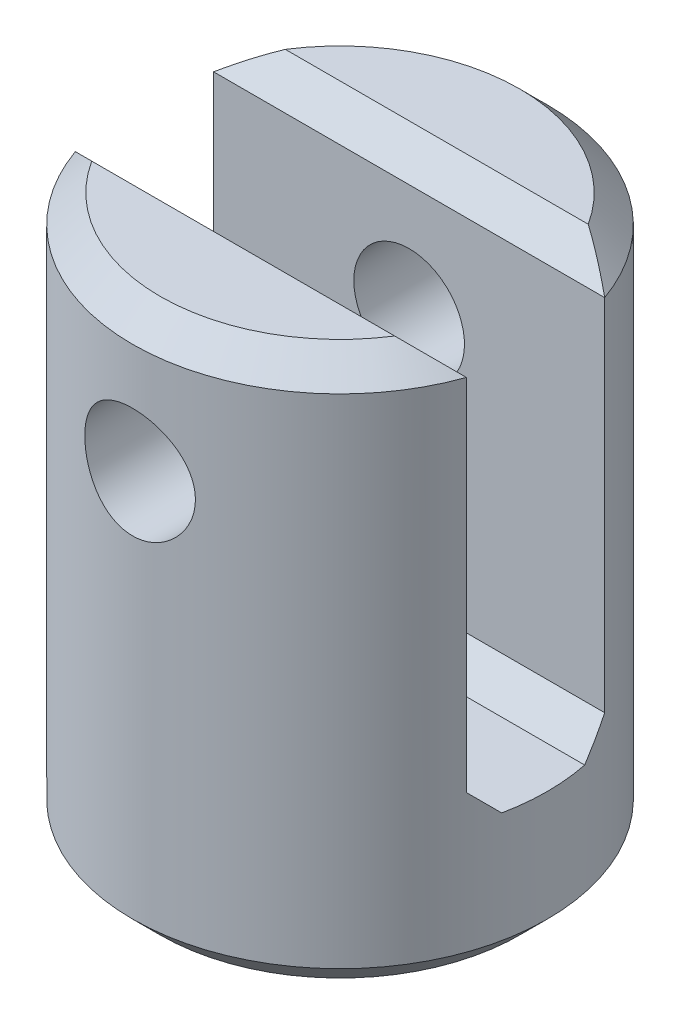
from build123d import *

# Parameters (mm, degrees)
ESBO_O1_R                  = 7.5
RESSALTO_EXTRUS_O1_DEPTH   = 10
CORTE_EXTRUS_O1_DEPTH      = 15.577379737
CORTE_EXTRUS_O1_DEPTH_BACK = 15.577379737
ESBO_O2_W                  = 5
ESBO_O2_H                  = 15
CORTE_EXTRUS_O2_DEPTH      = 15.577379737
CORTE_EXTRUS_O2_DEPTH_BACK = 15.577379737
ESBO_O3_R                  = 2
CHANFRO1_SIZE              = 1
CHANFRO2_SIZE              = 1
CHANFRO3_SIZE              = 1


with BuildPart() as part:
    # Esboço1 → Ressalto-extrusão1 (new, symmetric)
    with BuildSketch(Plane(origin=(0, 0, 0), x_dir=(1, 0, 0), z_dir=(0, 1, 0))):
        with Locations(Location((0, 0, 0), (0, 0, 270))):
            Circle(ESBO_O1_R)
    extrude(amount=RESSALTO_EXTRUS_O1_DEPTH, both=True)

    # Esboço2 → Corte-extrusão1 (cut, two sides: drawn at the far end of the back side and taken through both)
    with BuildSketch(Plane(origin=(0, 0, 0), x_dir=(0, 0, -1), z_dir=(1, 0, 0)).offset(-CORTE_EXTRUS_O1_DEPTH_BACK)):
        with Locations((0, 2.5)):
            Rectangle(ESBO_O2_W, ESBO_O2_H)
    extrude(amount=CORTE_EXTRUS_O1_DEPTH + CORTE_EXTRUS_O1_DEPTH_BACK, mode=Mode.SUBTRACT)

    # Esboço3 → Corte-extrusão2 (cut, two sides: drawn at the far end of the back side and taken through both)
    with BuildSketch(Plane.XY.offset(-CORTE_EXTRUS_O2_DEPTH_BACK)):
        with Locations(Location((0, 5, 0), (0, 0, 90))):
            Circle(ESBO_O3_R)
    extrude(amount=CORTE_EXTRUS_O2_DEPTH + CORTE_EXTRUS_O2_DEPTH_BACK, mode=Mode.SUBTRACT)

    # Chanfro1
    chanfro1_edges = [part.edges().sort_by_distance(p)[0] for p in [
        (0, -10, -7.5),
    ]]
    chamfer(chanfro1_edges, length=CHANFRO1_SIZE)

    # Chanfro2
    chanfro2_edges = [part.edges().sort_by_distance(p)[0] for p in [
        (0, 10, -7.5),
        (-4.330127019, 10, 6.123724357),
        (0, 10, -2.5),
        (0, 10, 2.5),
    ]]
    chamfer(chanfro2_edges, length=CHANFRO2_SIZE)

    # Chanfro3
    chanfro3_edges = [part.edges().sort_by_distance(p)[0] for p in [
        (0, -5, -2.5),
        (0, -5, 2.5),
    ]]
    chamfer(chanfro3_edges, length=CHANFRO3_SIZE)


solid = part.part
